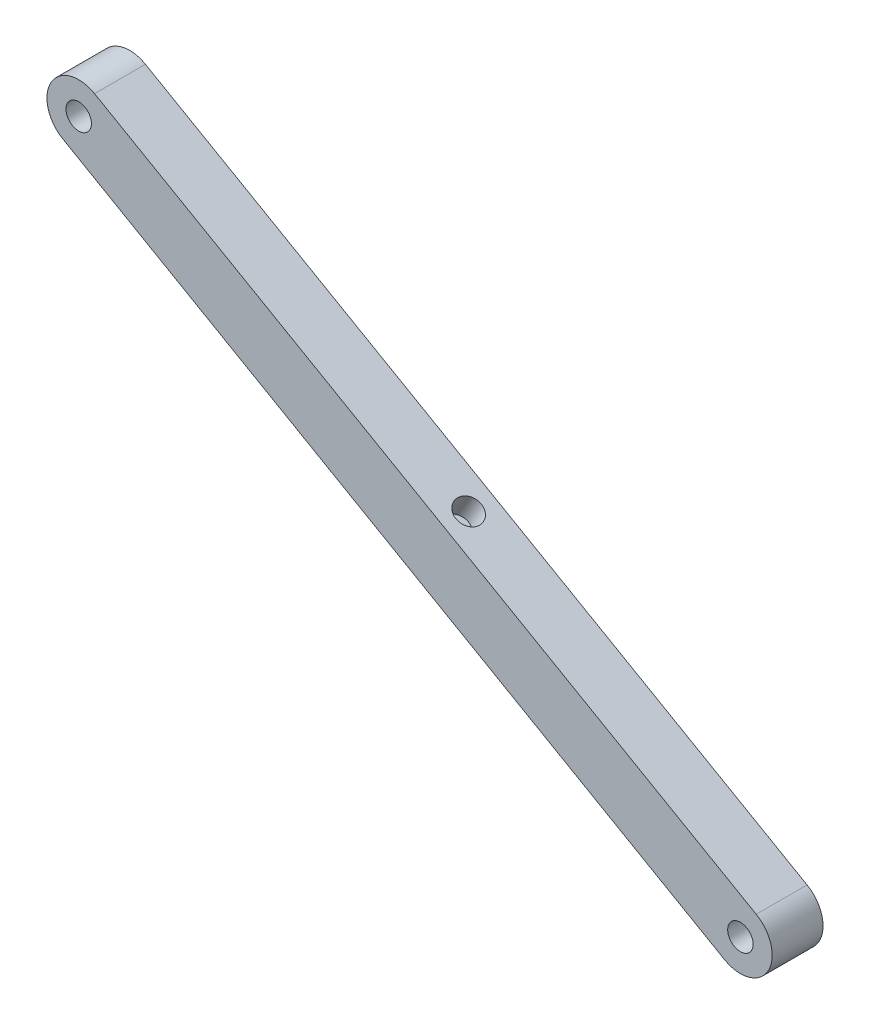
from build123d import *

# Parameters (mm, degrees)
SKETCH1_R           = 1
BOSS_EXTRUDE1_DEPTH = 4
SKETCH2_R           = 1
CUT_EXTRUDE1_DEPTH  = 2


with BuildPart() as part:
    # Sketch1 → Boss-Extrude1 (new body)
    with BuildSketch(Plane.XY):
        with BuildLine():
            Line((-56.056622595, 63.083032854), (-4.020390364, 33.212804613))
            ThreePointArc((-4.020390364, 33.212804613), (-3.096806864, 29.800035426), (-6.509576051, 28.876451927))
            Line((-6.509576051, 28.876451927), (-58.545808282, 58.746680168))
            ThreePointArc((-58.545808282, 58.746680168), (-59.469391781, 62.159449355), (-56.056622595, 63.083032854))
        make_face()
        with Locations((-57.301215438, 60.914856511)):
            Circle(SKETCH1_R, mode=Mode.SUBTRACT)
        with Locations((-5.264983207, 31.04462827)):
            Circle(SKETCH1_R, mode=Mode.SUBTRACT)
    extrude(amount=BOSS_EXTRUDE1_DEPTH)

    # Sketch2 → Cut-Extrude1 (cut)
    with BuildSketch(Plane(origin=(13.343522454, 23.245441166, 0), x_dir=(0.8672705371832455, -0.49783713735908147, 0), z_dir=(0.49783713735908147, 0.8672705371832455, 0))):
        with Locations(Location((-48.403705156, -2, 0), (0, 0, 180))):
            Circle(SKETCH2_R)
    extrude(amount=-CUT_EXTRUDE1_DEPTH, mode=Mode.SUBTRACT)


solid = part.part
